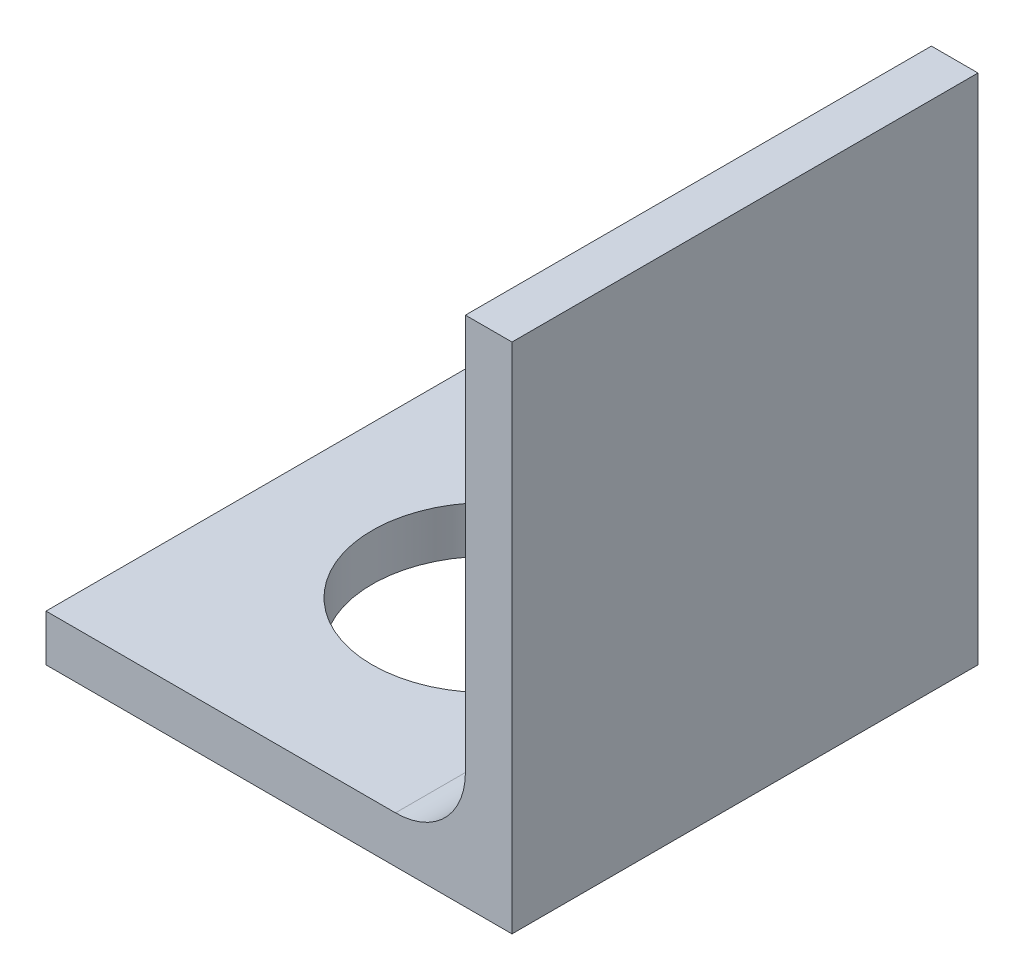
from build123d import *

# Parameters (mm, degrees)
SKETCH1_W           = 20
SKETCH1_H           = 2
BOSS_EXTRUDE1_DEPTH = 20
SKETCH2_W           = 2
SKETCH2_H           = 20
BOSS_EXTRUDE2_DEPTH = 20
SKETCH3_R           = 5
CUT_EXTRUDE1_DEPTH  = 30
FILLET1_R           = 3


with BuildPart() as part:
    # Sketch1 → Boss-Extrude1 (new body)
    with BuildSketch(Plane.XY):
        with Locations((10, -1)):
            Rectangle(SKETCH1_W, SKETCH1_H)
    extrude(amount=BOSS_EXTRUDE1_DEPTH)

    # Sketch2 → Boss-Extrude2 (add)
    with BuildSketch(Plane(origin=(0, 0, 0), x_dir=(1, 0, 0), z_dir=(0, 1, 0))):
        with Locations((19, -10)):
            Rectangle(SKETCH2_W, SKETCH2_H)
    extrude(amount=BOSS_EXTRUDE2_DEPTH)

    # Sketch3 → Cut-Extrude1 (cut)
    with BuildSketch(Plane(origin=(0, 0, 0), x_dir=(1, 0, 0), z_dir=(0, 1, 0))):
        with Locations(Location((9, -10, 0), (0, 0, 270))):
            Circle(SKETCH3_R)
    extrude(amount=-CUT_EXTRUDE1_DEPTH, mode=Mode.SUBTRACT)

    # Fillet1
    fillet1_edges = [part.edges().sort_by_distance(p)[0] for p in [
        (18, 0, 10),
    ]]
    fillet(fillet1_edges, radius=FILLET1_R)


solid = part.part
